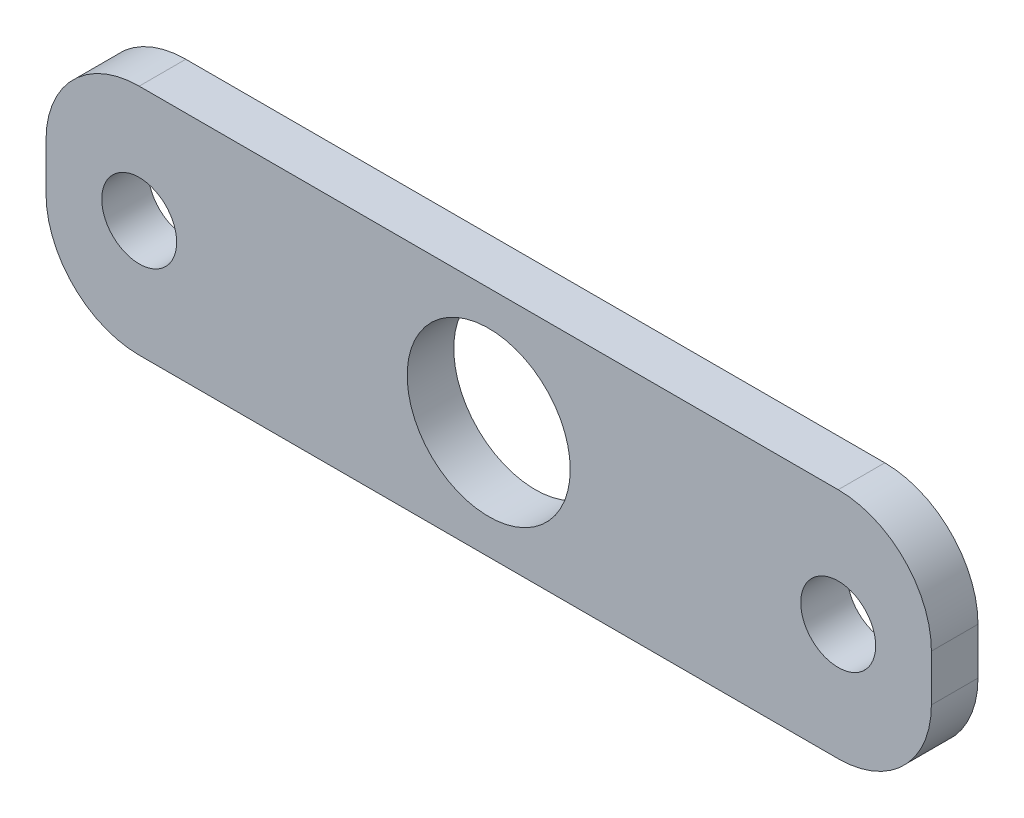
from build123d import *

# Parameters (mm, degrees)
SKETCH1_W           = 60.325
SKETCH1_H           = 15.875
SKETCH1_R           = 5.55625
SKETCH1_R_2         = 2.5527
BOSS_EXTRUDE1_DEPTH = 1.5875
FILLET3_R           = 6.35


with BuildPart() as part:
    # Sketch1 → Boss-Extrude1 (new, symmetric)
    with BuildSketch(Plane.XY):
        Rectangle(SKETCH1_W, SKETCH1_H)
        Circle(SKETCH1_R, mode=Mode.SUBTRACT)
        with Locations((23.8125, 0)):
            Circle(SKETCH1_R_2, mode=Mode.SUBTRACT)
        with Locations((-23.8125, 0)):
            Circle(SKETCH1_R_2, mode=Mode.SUBTRACT)
    extrude(amount=BOSS_EXTRUDE1_DEPTH, both=True)

    # Fillet3
    fillet3_edges = [part.edges().sort_by_distance(p)[0] for p in [
        (30.1625, -7.9375, 0),
        (-30.1625, -7.9375, 0),
        (-30.1625, 7.9375, 0),
        (30.1625, 7.9375, 0),
    ]]
    fillet(fillet3_edges, radius=FILLET3_R)


solid = part.part
